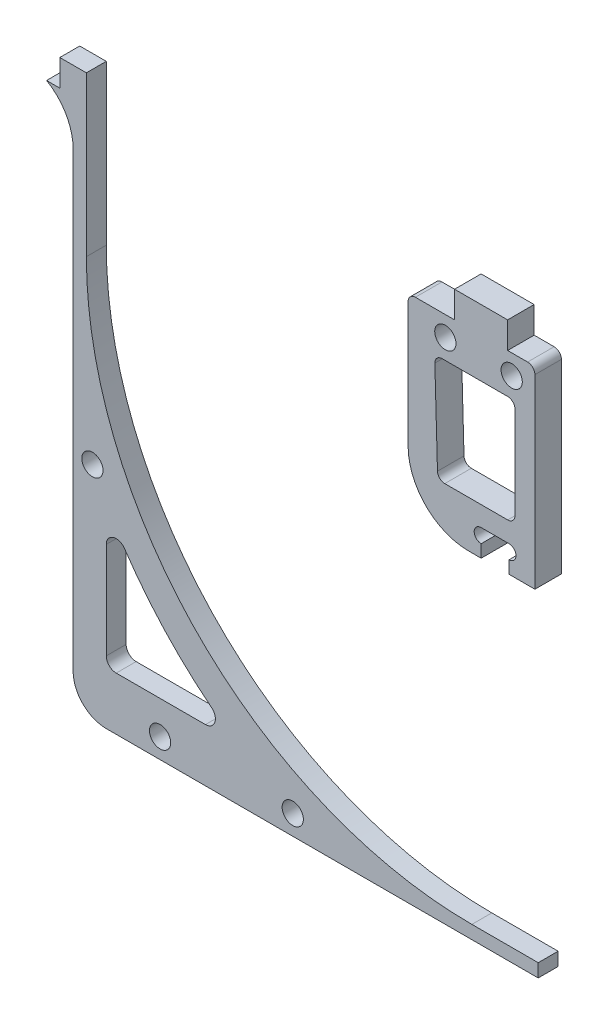
from build123d import *

# Parameters (mm, degrees)
EXTRUDE_1_DEPTH     = 2
EXTRUDE_2_DEPTH     = 1.5
FILLET_1_R          = 5
CUT_EXTRUDE_1_DEPTH = 10
SKETCH_5_R          = 1.6
CUT_EXTRUDE_2_DEPTH = 10
SKETCH_6_W          = 4.2
SKETCH_6_H          = 4.1
CUT_EXTRUDE_3_DEPTH = 10
SKETCH_7_R          = 1.05
CUT_EXTRUDE_4_DEPTH = 10
SKETCH_8_R          = 1.6
CUT_EXTRUDE_5_DEPTH = 10
SKETCH_9_W          = 8
SKETCH_9_H          = 4
EXTRUDE_3_DEPTH     = 4
EXTRUDE_4_DEPTH     = 3
FILLET_2_R          = 1.1
CUT_EXTRUDE_6_DEPTH = 10
FILLET_3_R          = 1.1
SKETCH_14_R         = 1.6
CUT_EXTRUDE_7_DEPTH = 10
CUT_EXTRUDE_8_DEPTH = 10
FILLET_4_R          = 1.5


with BuildPart() as part:
    # 草图1 → 凸台-拉伸1 (new, symmetric)
    with BuildSketch(Plane.XY):
        with BuildLine():
            Line((-9.112698372, 0), (-9.112698372, 20))
            Line((-9.112698372, 20), (10, 20))
            Line((10, 20), (10, -9.112698372))
            Line((10, -9.112698372), (0, -9.112698372))
            ThreePointArc((0, -9.112698372), (-6.443650814, -6.443650814), (-9.112698372, 0))
        make_face()
    extrude(amount=EXTRUDE_1_DEPTH, both=True)

    # 草图6 → 切除-拉伸3 (cut)
    with BuildSketch(Plane.XY.offset(2)):
        with Locations((4, -7.162698372)):
            Rectangle(SKETCH_6_W, SKETCH_6_H)
    extrude(amount=-CUT_EXTRUDE_3_DEPTH, mode=Mode.SUBTRACT)

    # 草图7 → 切除-拉伸4 (cut)
    with BuildSketch(Plane.XY.offset(2)):
        with Locations((1.9, -6.162698372)):
            Circle(SKETCH_7_R)
        with Locations((6.1, -6.162698372)):
            Circle(SKETCH_7_R)
    extrude(amount=-CUT_EXTRUDE_4_DEPTH, mode=Mode.SUBTRACT)

    # 草图8 → 切除-拉伸5 (cut)
    with BuildSketch(Plane.XY.offset(2)):
        with Locations((6.5, 17)):
            Circle(SKETCH_8_R)
        with Locations((-3.5, 17)):
            Circle(SKETCH_8_R)
    extrude(amount=-CUT_EXTRUDE_5_DEPTH, mode=Mode.SUBTRACT)

    # 草图9 → 凸台-拉伸3 (add)
    with BuildSketch(Plane.XY.offset(2)):
        with Locations((1.887301628, 22)):
            Rectangle(SKETCH_9_W, SKETCH_9_H)
    extrude(amount=-EXTRUDE_3_DEPTH)

    # 圆角2
    fillet_2_edges = [part.edges().sort_by_distance(p)[0] for p in [
        (-9.112698372, 20, 0),
        (10, 20, 0),
    ]]
    fillet(fillet_2_edges, radius=FILLET_2_R)

    # 草图12 → 切除-拉伸6 (cut)
    with BuildSketch(Plane.XY.offset(2)):
        Polygon((-5.112698372, 14), (7, 14), (7, -2.112698372), (-4.655769564, -2.112698372), align=None)
    extrude(amount=-CUT_EXTRUDE_6_DEPTH, mode=Mode.SUBTRACT)

    # 圆角3
    fillet_3_edges = [part.edges().sort_by_distance(p)[0] for p in [
        (-4.655769564, -2.112698372, 0),
        (-5.112698372, 14, 0),
        (7, 14, 0),
        (7, -2.112698372, 0),
    ]]
    fillet(fillet_3_edges, radius=FILLET_3_R)


with BuildPart() as body_2:
    # 草图2 → 凸台-拉伸2 (new, symmetric)
    with BuildSketch(Plane.XY):
        with BuildLine():
            Line((0, -53.112698372), (10, -53.112698372))
            Line((10, -53.112698372), (10, -60.112698372))
            Line((10, -60.112698372), (-60.112698372, -60.112698372))
            Line((-60.112698372, -60.112698372), (-60.112698372, 20))
            Line((-60.112698372, 20), (-53.112698372, 20))
            Line((-53.112698372, 20), (-53.112698372, 0))
            ThreePointArc((-53.112698372, 0), (-37.556349186, -37.556349186), (0, -53.112698372))
        make_face()
    extrude(amount=EXTRUDE_2_DEPTH, both=True)

    # 圆角1
    fillet_1_edges = [body_2.edges().sort_by_distance(p)[0] for p in [
        (-60.112698372, -60.112698372, 0),
    ]]
    fillet(fillet_1_edges, radius=FILLET_1_R)

    # 草图4 → 切除-拉伸1 (cut)
    with BuildSketch(Plane.XY.offset(1.5)):
        with BuildLine():
            Line((-58.112698372, 20), (-53.112698372, 20))
            Line((-53.112698372, 20), (-53.112698372, 0))
            ThreePointArc((-53.112698372, 0), (-37.556349186, -37.556349186), (0, -53.112698372))
            Line((0, -53.112698372), (10, -53.112698372))
            Line((10, -53.112698372), (10, -58.112698372))
            Line((10, -58.112698372), (0, -58.112698372))
            ThreePointArc((0, -58.112698372), (-41.091883092, -41.091883092), (-58.112698372, 0))
            Line((-58.112698372, 0), (-58.112698372, 20))
        make_face()
    extrude(amount=-CUT_EXTRUDE_1_DEPTH, mode=Mode.SUBTRACT)

    # 草图5 → 切除-拉伸2 (cut)
    with BuildSketch(Plane(origin=(0, 0, -1.5), x_dir=(-1, 0, 0), z_dir=(0, 0, -1))):
        with Locations((57.199529996, -26.67257888)):
            Circle(SKETCH_5_R)
    extrude(amount=-CUT_EXTRUDE_2_DEPTH, mode=Mode.SUBTRACT)

    # 草图11 → 凸台-拉伸4 (add)
    with BuildSketch(Plane.XY.offset(1.5)):
        with BuildLine():
            Line((-58.112698372, 20), (-58.112698372, 24))
            Line((-58.112698372, 24), (-62.112698372, 24))
            Line((-62.112698372, 24), (-62.112698372, 20))
            Line((-62.112698372, 20), (-64.112698372, 20))
            ThreePointArc((-64.112698372, 20), (-61.184495142, 17.07179677), (-60.112698372, 13.07179677))
            Line((-60.112698372, 13.07179677), (-60.112698372, 18))
            Line((-60.112698372, 18), (-58.112698372, 18))
            Line((-58.112698372, 18), (-58.112698372, 20))
        make_face()
    extrude(amount=-EXTRUDE_4_DEPTH)

    # 草图14 → 切除-拉伸7 (cut)
    with BuildSketch(Plane(origin=(0, 0, -1.5), x_dir=(-1, 0, 0), z_dir=(0, 0, -1))):
        with Locations((47, -57.112698372)):
            Circle(SKETCH_14_R)
        with Locations((27, -57.112698372)):
            Circle(SKETCH_14_R)
    extrude(amount=-CUT_EXTRUDE_7_DEPTH, mode=Mode.SUBTRACT)

    # 草图15 → 切除-拉伸8 (cut)
    with BuildSketch(Plane(origin=(0, 0, -1.5), x_dir=(-1, 0, 0), z_dir=(0, 0, -1))):
        with BuildLine():
            Line((35.601676424, -52.112698372), (55.112698372, -52.112698372))
            Line((55.112698372, -52.112698372), (55.112698372, -30.753913149))
            ThreePointArc((55.112698372, -30.753913149), (46.597466403, -42.566287372), (35.601676424, -52.112698372))
        make_face()
    extrude(amount=-CUT_EXTRUDE_8_DEPTH, mode=Mode.SUBTRACT)

    # 圆角4
    fillet_4_edges = [body_2.edges().sort_by_distance(p)[0] for p in [
        (-35.601676424, -52.112698372, 0),
        (-55.112698372, -30.753913149, 0),
        (-55.112698372, -52.112698372, 0),
    ]]
    fillet(fillet_4_edges, radius=FILLET_4_R)


solid = Compound([part.part, body_2.part])
